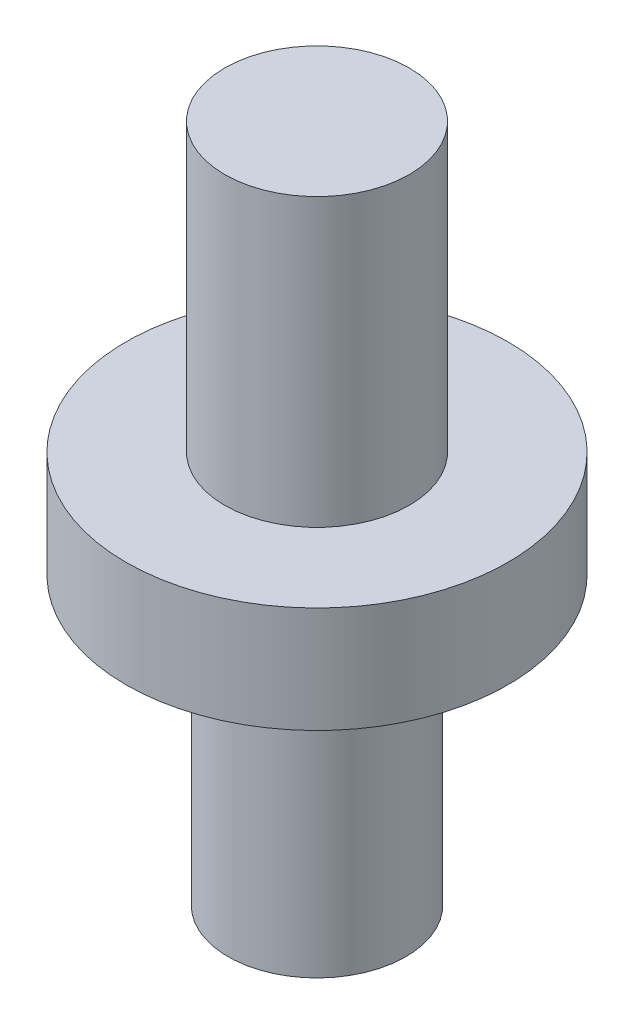
from build123d import *

# Parameters (mm, degrees)
SKETCH2_R           = 2.175
BOSS_EXTRUDE2_DEPTH = 8
SKETCH5_R           = 2.095
BOSS_EXTRUDE3_DEPTH = 8
SKETCH7_R           = 4.5
BOSS_EXTRUDE4_DEPTH = 1.25


with BuildPart() as part:
    # Sketch2 → Boss-Extrude2 (new body)
    with BuildSketch(Plane(origin=(0, 0, 0), x_dir=(1, 0, 0), z_dir=(0, 1, 0))):
        with Locations(Location((0, 0, 0), (0, 0, 270))):
            Circle(SKETCH2_R)
    extrude(amount=BOSS_EXTRUDE2_DEPTH)

    # Sketch5 → Boss-Extrude3 (add)
    with BuildSketch(Plane(origin=(0, 0, 0), x_dir=(-1, 0, 0), z_dir=(0, -1, 0))):
        with Locations(Location((0, 0, 0), (0, 0, 90))):
            Circle(SKETCH5_R)
    extrude(amount=BOSS_EXTRUDE3_DEPTH)

    # Sketch7 → Boss-Extrude4 (add, symmetric)
    with BuildSketch(Plane(origin=(0, 0, 0), x_dir=(-1, 0, 0), z_dir=(0, -1, 0))):
        with Locations(Location((0, 0, 0), (0, 0, 90))):
            Circle(SKETCH7_R)
    extrude(amount=BOSS_EXTRUDE4_DEPTH, both=True)


solid = part.part
